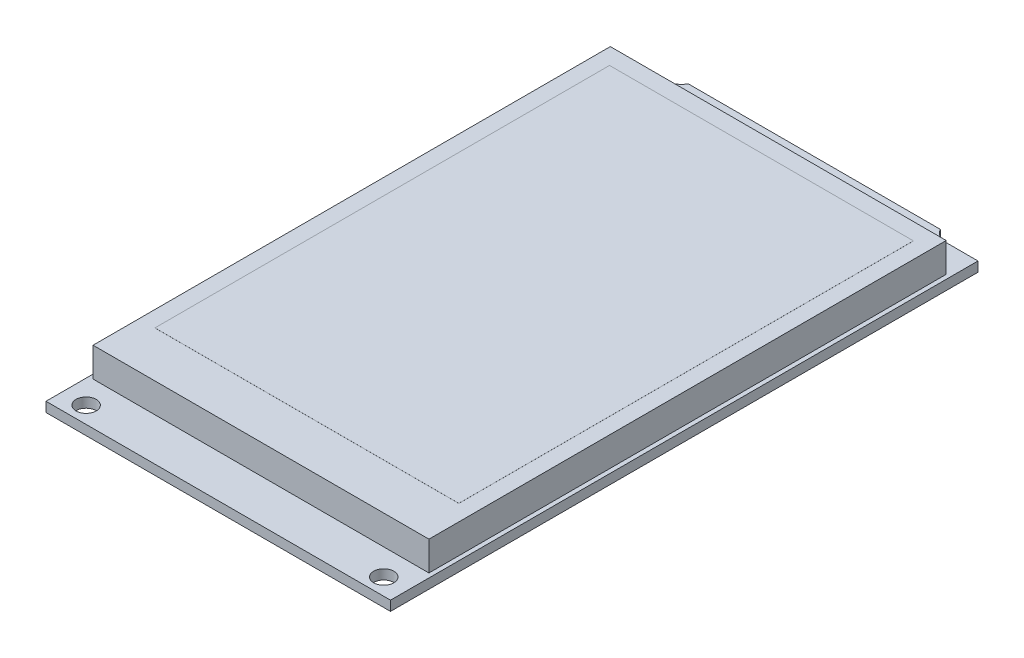
from build123d import *

# Parameters (mm, degrees)
SKETCH_1_R      = 1.65
EXTRUDE_1_DEPTH = 1.6
EXTRUDE_2_DEPTH = 4.8
EXTRUDE_3_DEPTH = 0.01


with BuildPart() as part:
    # 草图1 → 凸台-拉伸1 (new body)
    with BuildSketch(Plane(origin=(0, 0, 0), x_dir=(1, 0, 0), z_dir=(0, 1, 0))):
        with BuildLine():
            Line((27.181335969, 0), (83.591335969, 0))
            Line((83.591335969, 0), (83.591335969, 96.2))
            Line((83.591335969, 96.2), (78.265479271, 96.2))
            ThreePointArc((78.265479271, 96.2), (76.9576214, 96.598857266), (76.026335969, 97.6))
            Line((76.026335969, 97.6), (55.386335969, 97.6))
            Line((55.386335969, 97.6), (34.746335969, 97.6))
            ThreePointArc((34.746335969, 97.6), (33.815050539, 96.598857266), (32.507192668, 96.2))
            Line((32.507192668, 96.2), (27.181335969, 96.2))
            Line((27.181335969, 96.2), (27.181335969, 0))
        make_face()
        with Locations(Location((31.021335969, 2.73, 0), (0, 0, 270))):
            Circle(SKETCH_1_R, mode=Mode.SUBTRACT)
        with Locations(Location((79.751335969, 2.73, 0), (0, 0, 90))):
            Circle(SKETCH_1_R, mode=Mode.SUBTRACT)
    extrude(amount=EXTRUDE_1_DEPTH)

    # 草图3 → 凸台-拉伸2 (add)
    with BuildSketch(Plane(origin=(0, 1.6, 0), x_dir=(1, 0, 0), z_dir=(0, 1, 0))):
        Polygon((55.386335969, 7), (27.886335969, 7), (27.886335969, 91.7), (82.886335969, 91.7), (82.886335969, 7), align=None)
    extrude(amount=EXTRUDE_2_DEPTH)

    # 草图4 → 凸台-拉伸3 (add)
    with BuildSketch(Plane(origin=(0, 6.4, 0), x_dir=(1, 0, 0), z_dir=(0, 1, 0))):
        Polygon((55.386335969, 88.95), (30.506335969, 88.95), (30.506335969, 14.51), (80.266335969, 14.51), (80.266335969, 88.95), align=None)
    extrude(amount=EXTRUDE_3_DEPTH)


solid = part.part
